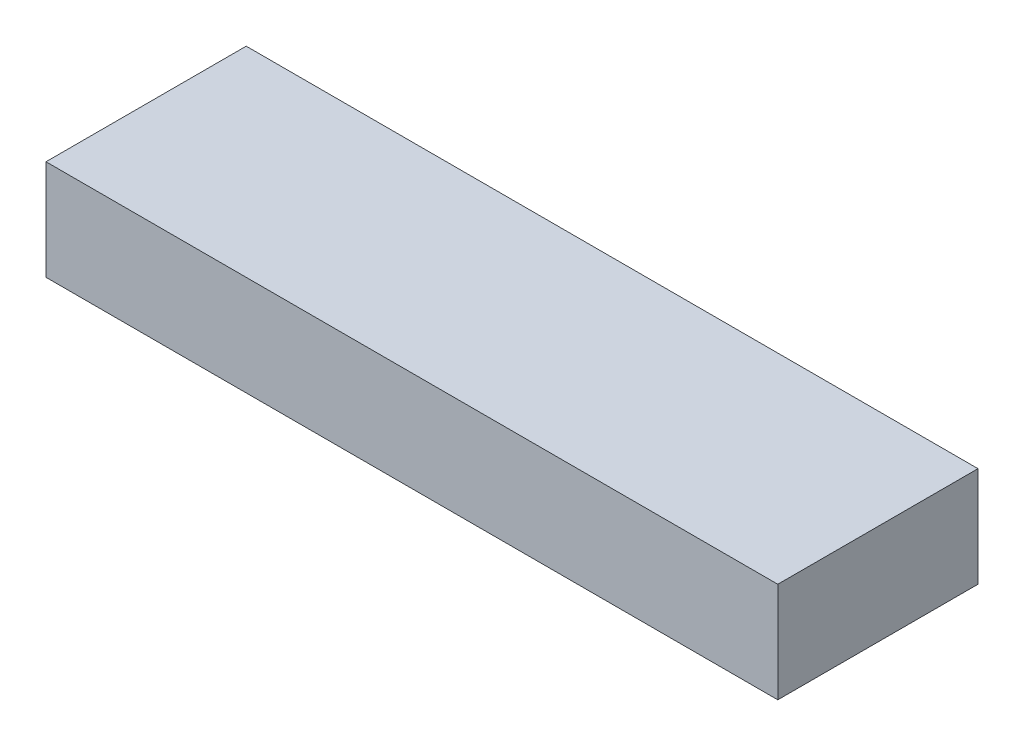
from build123d import *

# Parameters (mm, degrees)
SKETCH1_W           = 73.1
SKETCH1_H           = 20
BOSS_EXTRUDE1_DEPTH = 10


with BuildPart() as part:
    # Sketch1 → Boss-Extrude1 (new body)
    with BuildSketch(Plane(origin=(0, 0, 0), x_dir=(1, 0, 0), z_dir=(0, 1, 0))):
        with Locations((36.55, 10)):
            Rectangle(SKETCH1_W, SKETCH1_H)
    extrude(amount=-BOSS_EXTRUDE1_DEPTH)


solid = part.part
